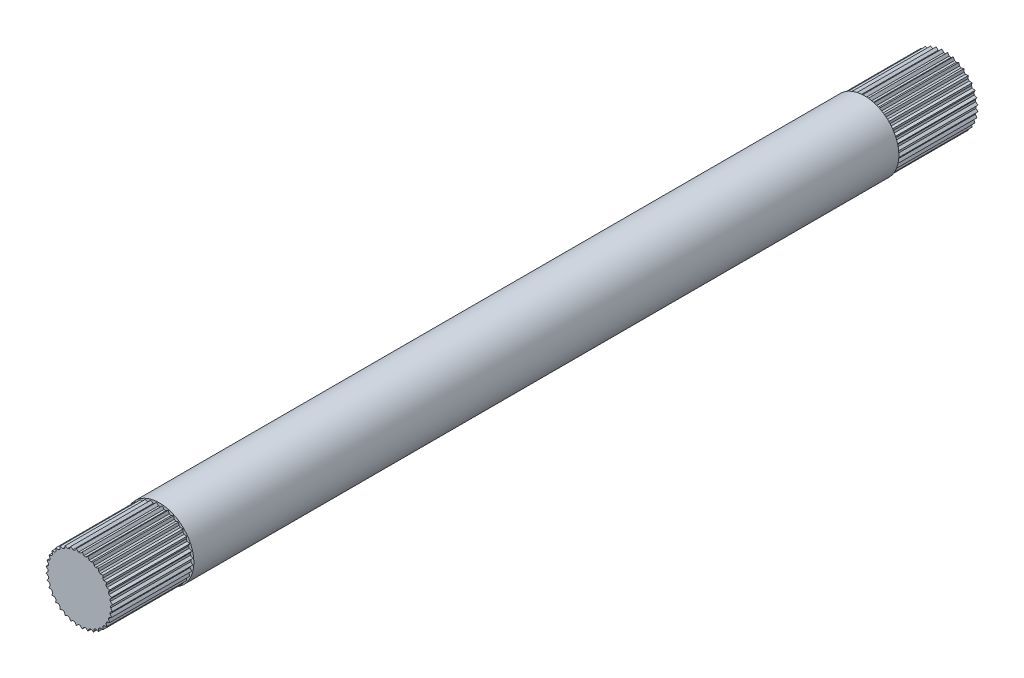
from build123d import *

# Parameters (mm, degrees)
SKETCH5_W           = 1.587499994
SKETCH5_H           = 239.930081988
CUT_EXTRUDE7_START  = 262.091582
SKETCH8_R           = 12.7
CUT_EXTRUDE7_DEPTH  = 22.225
SKETCH10_R          = 7.9375
BOSS_EXTRUDE1_DEPTH = 214.530081988
CUT_EXTRUDE8_START  = 22.1615
SKETCH12_R          = 12.7
CUT_EXTRUDE8_DEPTH  = 22.225


with BuildPart() as part:
    # Sketch5 → Revolve2 (revolve)
    with BuildSketch(Plane(origin=(0, 0, 0), x_dir=(1, 0, 0), z_dir=(0, 1, 0)), mode=Mode.PRIVATE) as revolve2_sk:
        with Locations((8.731249997, -142.126540994)):
            Rectangle(SKETCH5_W, SKETCH5_H)
    revolve(revolve2_sk.sketch.rotate(Axis((0, 0, 0), (0, 0, 1)), 180), axis=Axis((0, 0, 0), (0, 0, 1)))

    # Sketch8 → Cut-Extrude7 (cut)
    with BuildSketch(Plane.XY.offset(CUT_EXTRUDE7_START)):
        Circle(SKETCH8_R)
        Polygon((9.235721046, -0.808020891), (8.681700155, -0.254), (8.681700155, 0.254), (9.235721046, 0.808020891), (8.593912259, 1.257420242), (8.505698985, 1.75770258), (8.955098336, 2.399511367), (8.245002688, 2.730634406), (8.071256455, 3.207998257), (8.402379494, 3.918093905), (7.645572882, 4.120879625), (7.391572882, 4.56082053), (7.594358603, 5.317627141), (6.813836213, 5.385914002), (6.487300108, 5.775064579), (6.555586968, 6.555586968), (5.775064579, 6.487300108), (5.385914002, 6.813836213), (5.317627141, 7.594358603), (4.56082053, 7.391572882), (4.120879625, 7.645572882), (3.918093905, 8.402379494), (3.207998257, 8.071256455), (2.730634406, 8.245002688), (2.399511367, 8.955098336), (1.75770258, 8.505698985), (1.257420242, 8.593912259), (0.808020891, 9.235721046), (0.254, 8.681700155), (-0.254, 8.681700155), (-0.808020891, 9.235721046), (-1.257420242, 8.593912259), (-1.75770258, 8.505698985), (-2.399511367, 8.955098336), (-2.730634406, 8.245002688), (-3.207998257, 8.071256455), (-3.918093905, 8.402379494), (-4.120879625, 7.645572882), (-4.56082053, 7.391572882), (-5.317627141, 7.594358603), (-5.385914002, 6.813836213), (-5.775064579, 6.487300108), (-6.555586968, 6.555586968), (-6.487300108, 5.775064579), (-6.813836213, 5.385914002), (-7.594358603, 5.317627141), (-7.391572882, 4.56082053), (-7.645572882, 4.120879625), (-8.402379494, 3.918093905), (-8.071256455, 3.207998257), (-8.245002688, 2.730634406), (-8.955098336, 2.399511367), (-8.505698985, 1.75770258), (-8.593912259, 1.257420242), (-9.235721046, 0.808020891), (-8.681700155, 0.254), (-8.681700155, -0.254), (-9.235721046, -0.808020891), (-8.593912259, -1.257420242), (-8.505698985, -1.75770258), (-8.955098336, -2.399511367), (-8.245002688, -2.730634406), (-8.071256455, -3.207998257), (-8.402379494, -3.918093905), (-7.645572882, -4.120879625), (-7.391572882, -4.56082053), (-7.594358603, -5.317627141), (-6.813836213, -5.385914002), (-6.487300108, -5.775064579), (-6.555586968, -6.555586968), (-5.775064579, -6.487300108), (-5.385914002, -6.813836213), (-5.317627141, -7.594358603), (-4.56082053, -7.391572882), (-4.120879625, -7.645572882), (-3.918093905, -8.402379494), (-3.207998257, -8.071256455), (-2.730634406, -8.245002688), (-2.399511367, -8.955098336), (-1.75770258, -8.505698985), (-1.257420242, -8.593912259), (-0.808020891, -9.235721046), (-0.254, -8.681700155), (0.254, -8.681700155), (0.808020891, -9.235721046), (1.257420242, -8.593912259), (1.75770258, -8.505698985), (2.399511367, -8.955098336), (2.730634406, -8.245002688), (3.207998257, -8.071256455), (3.918093905, -8.402379494), (4.120879625, -7.645572882), (4.56082053, -7.391572882), (5.317627141, -7.594358603), (5.385914002, -6.813836213), (5.775064579, -6.487300108), (6.555586968, -6.555586968), (6.487300108, -5.775064579), (6.813836213, -5.385914002), (7.594358603, -5.317627141), (7.391572882, -4.56082053), (7.645572882, -4.120879625), (8.402379494, -3.918093905), (8.071256455, -3.207998257), (8.245002688, -2.730634406), (8.955098336, -2.399511367), (8.505698985, -1.75770258), (8.593912259, -1.257420242), align=None, mode=Mode.SUBTRACT)
    extrude(amount=-CUT_EXTRUDE7_DEPTH, mode=Mode.SUBTRACT)

    # Sketch10 → Boss-Extrude1 (add)
    with BuildSketch(Plane(origin=(0, 0, 47.5615), x_dir=(-1, 0, 0), z_dir=(0, 0, -1))):
        Circle(SKETCH10_R)
    extrude(amount=-BOSS_EXTRUDE1_DEPTH)

    # Sketch12 → Cut-Extrude8 (cut)
    with BuildSketch(Plane.XY.offset(CUT_EXTRUDE8_START)):
        Circle(SKETCH12_R)
        Polygon((9.235721046, -0.808020891), (8.681700155, -0.254), (8.681700155, 0.254), (9.235721046, 0.808020891), (8.593912259, 1.257420242), (8.505698985, 1.75770258), (8.955098336, 2.399511367), (8.245002688, 2.730634406), (8.071256455, 3.207998257), (8.402379494, 3.918093905), (7.645572882, 4.120879625), (7.391572882, 4.56082053), (7.594358603, 5.317627141), (6.813836213, 5.385914002), (6.487300108, 5.775064579), (6.555586968, 6.555586968), (5.775064579, 6.487300108), (5.385914002, 6.813836213), (5.317627141, 7.594358603), (4.56082053, 7.391572882), (4.120879625, 7.645572882), (3.918093905, 8.402379494), (3.207998257, 8.071256455), (2.730634406, 8.245002688), (2.399511367, 8.955098336), (1.75770258, 8.505698985), (1.257420242, 8.593912259), (0.808020891, 9.235721046), (0.254, 8.681700155), (-0.254, 8.681700155), (-0.808020891, 9.235721046), (-1.257420242, 8.593912259), (-1.75770258, 8.505698985), (-2.399511367, 8.955098336), (-2.730634406, 8.245002688), (-3.207998257, 8.071256455), (-3.918093905, 8.402379494), (-4.120879625, 7.645572882), (-4.56082053, 7.391572882), (-5.317627141, 7.594358603), (-5.385914002, 6.813836213), (-5.775064579, 6.487300108), (-6.555586968, 6.555586968), (-6.487300108, 5.775064579), (-6.813836213, 5.385914002), (-7.594358603, 5.317627141), (-7.391572882, 4.56082053), (-7.645572882, 4.120879625), (-8.402379494, 3.918093905), (-8.071256455, 3.207998257), (-8.245002688, 2.730634406), (-8.955098336, 2.399511367), (-8.505698985, 1.75770258), (-8.593912259, 1.257420242), (-9.235721046, 0.808020891), (-8.681700155, 0.254), (-8.681700155, -0.254), (-9.235721046, -0.808020891), (-8.593912259, -1.257420242), (-8.505698985, -1.75770258), (-8.955098336, -2.399511367), (-8.245002688, -2.730634406), (-8.071256455, -3.207998257), (-8.402379494, -3.918093905), (-7.645572882, -4.120879625), (-7.391572882, -4.56082053), (-7.594358603, -5.317627141), (-6.813836213, -5.385914002), (-6.487300108, -5.775064579), (-6.555586968, -6.555586968), (-5.775064579, -6.487300108), (-5.385914002, -6.813836213), (-5.317627141, -7.594358603), (-4.56082053, -7.391572882), (-4.120879625, -7.645572882), (-3.918093905, -8.402379494), (-3.207998257, -8.071256455), (-2.730634406, -8.245002688), (-2.399511367, -8.955098336), (-1.75770258, -8.505698985), (-1.257420242, -8.593912259), (-0.808020891, -9.235721046), (-0.254, -8.681700155), (0.254, -8.681700155), (0.808020891, -9.235721046), (1.257420242, -8.593912259), (1.75770258, -8.505698985), (2.399511367, -8.955098336), (2.730634406, -8.245002688), (3.207998257, -8.071256455), (3.918093905, -8.402379494), (4.120879625, -7.645572882), (4.56082053, -7.391572882), (5.317627141, -7.594358603), (5.385914002, -6.813836213), (5.775064579, -6.487300108), (6.555586968, -6.555586968), (6.487300108, -5.775064579), (6.813836213, -5.385914002), (7.594358603, -5.317627141), (7.391572882, -4.56082053), (7.645572882, -4.120879625), (8.402379494, -3.918093905), (8.071256455, -3.207998257), (8.245002688, -2.730634406), (8.955098336, -2.399511367), (8.505698985, -1.75770258), (8.593912259, -1.257420242), align=None, mode=Mode.SUBTRACT)
    extrude(amount=CUT_EXTRUDE8_DEPTH, mode=Mode.SUBTRACT)


solid = part.part
